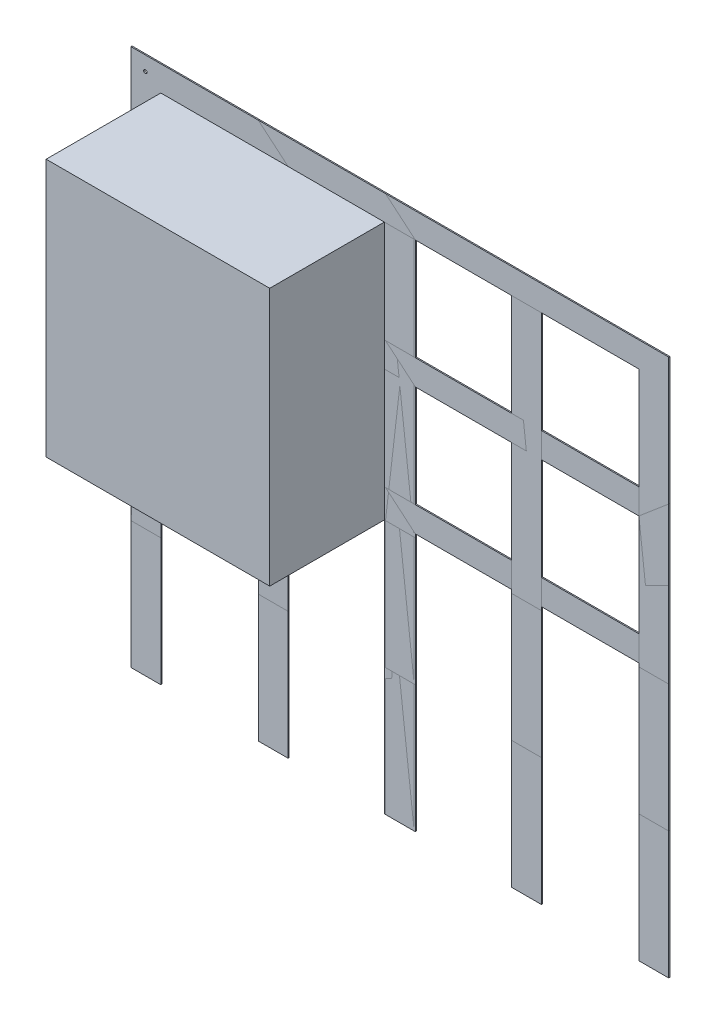
from build123d import *

# Parameters (mm, degrees)
SKETCH1_W                    = 390
SKETCH1_H                    = 450
EXTRUSION2_DEPTH             = 200
SHELL2_T                     = -2
EXTRUSION3_DEPTH             = 2
SKETCH3_W                    = 3
SKETCH3_H                    = 2
RECTANGULAR_PATTERN1_COUNT   = 3
RECTANGULAR_PATTERN1_PITCH   = 222
RECTANGULAR_PATTERN1_2_COUNT = 3
RECTANGULAR_PATTERN1_2_PITCH = 222
SKETCH5_W                    = 386
SKETCH5_H                    = 198
EXTRUSION4_DEPTH             = 2


with BuildPart() as part:
    # Sketch1 → Extrusion2 (new body)
    with BuildSketch(Plane.XY):
        with Locations((0, -22)):
            Rectangle(SKETCH1_W, SKETCH1_H)
    extrude(amount=EXTRUSION2_DEPTH)

    # Shell2
    shell2_openings = [part.faces().sort_by_distance(p)[0] for p in [
        (0, -22, 0),
    ]]
    offset(amount=SHELL2_T, openings=shell2_openings, kind=Kind.INTERSECTION)

    # Sketch5 → Extrusion4 (cut)
    with BuildSketch(Plane(origin=(0, -245, 0), x_dir=(-1, 0, 0), z_dir=(0, 1, 0))):
        with Locations((0, 99)):
            Rectangle(SKETCH5_W, SKETCH5_H)
    extrude(amount=-EXTRUSION4_DEPTH, mode=Mode.SUBTRACT)


with BuildPart() as body_2:
    # Sketch2 → Extrusion3 (new body)
    with BuildSketch(Plane.XY):
        Polygon((-247, -247), (-195, -247), (-195, 203), (195, 203), (195, -247), (247, -247), (247, 247), (-247, 247), align=None)
    extrude(amount=-EXTRUSION3_DEPTH)

    # Sketch3 → Hole1 (revolve, cut)
    with BuildSketch(Plane(origin=(-222, 222, 0), x_dir=(0, -1, 0), z_dir=(1, 0, 0))):
        with Locations((1.5, 1)):
            Rectangle(SKETCH3_W, SKETCH3_H)
    revolve(axis=Axis((-222, 222, -110), (0, 0, 1)), mode=Mode.SUBTRACT)


with BuildPart() as rectangular_pattern1_1:
    # Rectangular Pattern1: pattern copy
    add(body_2.part.moved(Location(Vector(1, 0, 0) * (1 * RECTANGULAR_PATTERN1_PITCH))))


with BuildPart() as rectangular_pattern1_2:
    # Rectangular Pattern1: pattern copy
    add(body_2.part.moved(Location(Vector(1, 0, 0) * (2 * RECTANGULAR_PATTERN1_PITCH))))


with BuildPart() as rectangular_pattern1_2_1:
    # Rectangular Pattern1 2: pattern copy
    add(body_2.part.moved(Location(Vector(0, -1, 0) * (1 * RECTANGULAR_PATTERN1_2_PITCH))))


with BuildPart() as rectangular_pattern1_2_2:
    # Rectangular Pattern1 2: pattern copy
    add(body_2.part.moved(Location(Vector(0, -1, 0) * (2 * RECTANGULAR_PATTERN1_2_PITCH))))


with BuildPart() as rectangular_pattern1_2_3:
    # Rectangular Pattern1 2: pattern copy
    add(rectangular_pattern1_1.part.moved(Location(Vector(0, -1, 0) * (1 * RECTANGULAR_PATTERN1_2_PITCH))))


with BuildPart() as rectangular_pattern1_2_4:
    # Rectangular Pattern1 2: pattern copy
    add(rectangular_pattern1_1.part.moved(Location(Vector(0, -1, 0) * (2 * RECTANGULAR_PATTERN1_2_PITCH))))


with BuildPart() as rectangular_pattern1_2_5:
    # Rectangular Pattern1 2: pattern copy
    add(rectangular_pattern1_2.part.moved(Location(Vector(0, -1, 0) * (1 * RECTANGULAR_PATTERN1_2_PITCH))))


with BuildPart() as rectangular_pattern1_2_6:
    # Rectangular Pattern1 2: pattern copy
    add(rectangular_pattern1_2.part.moved(Location(Vector(0, -1, 0) * (2 * RECTANGULAR_PATTERN1_2_PITCH))))


solid = Compound([part.part, body_2.part, rectangular_pattern1_1.part, rectangular_pattern1_2.part, rectangular_pattern1_2_1.part, rectangular_pattern1_2_2.part, rectangular_pattern1_2_3.part, rectangular_pattern1_2_4.part, rectangular_pattern1_2_5.part, rectangular_pattern1_2_6.part])
